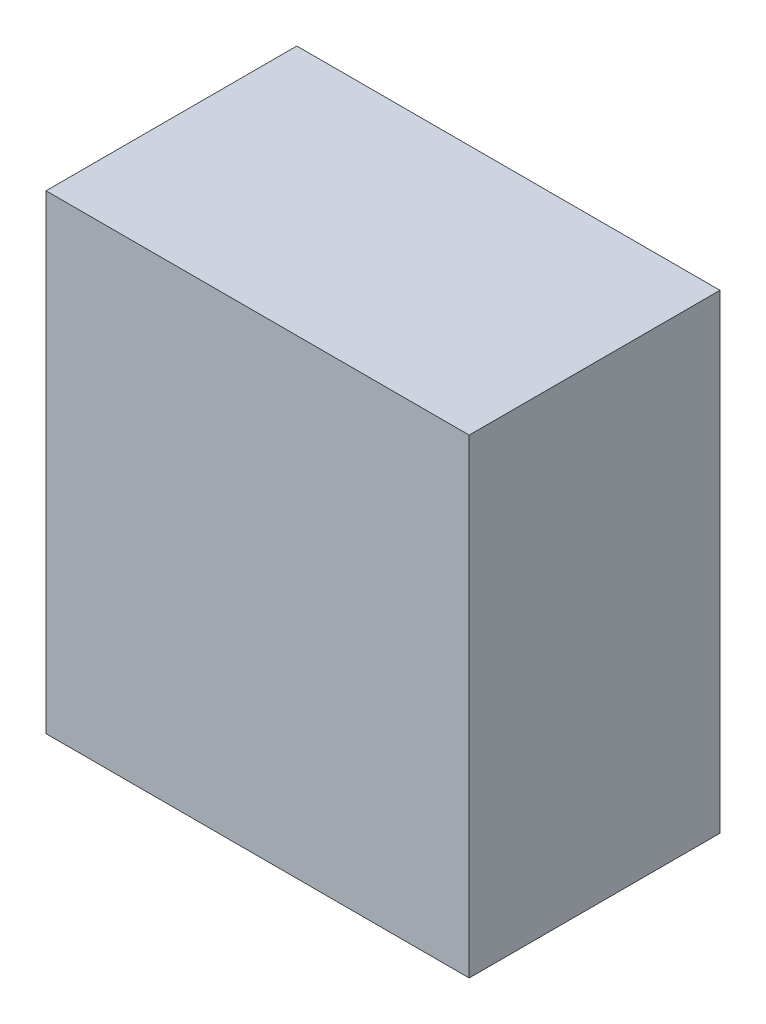
from build123d import *

# Parameters (mm, degrees)
SKETCH1_W           = 5.4
SKETCH1_H           = 3.2
BOSS_EXTRUDE1_DEPTH = 6


with BuildPart() as part:
    # Sketch1 → Boss-Extrude1 (new body)
    with BuildSketch(Plane(origin=(0, 0, 0), x_dir=(1, 0, 0), z_dir=(0, 1, 0))):
        Rectangle(SKETCH1_W, SKETCH1_H)
    extrude(amount=BOSS_EXTRUDE1_DEPTH)


solid = part.part
